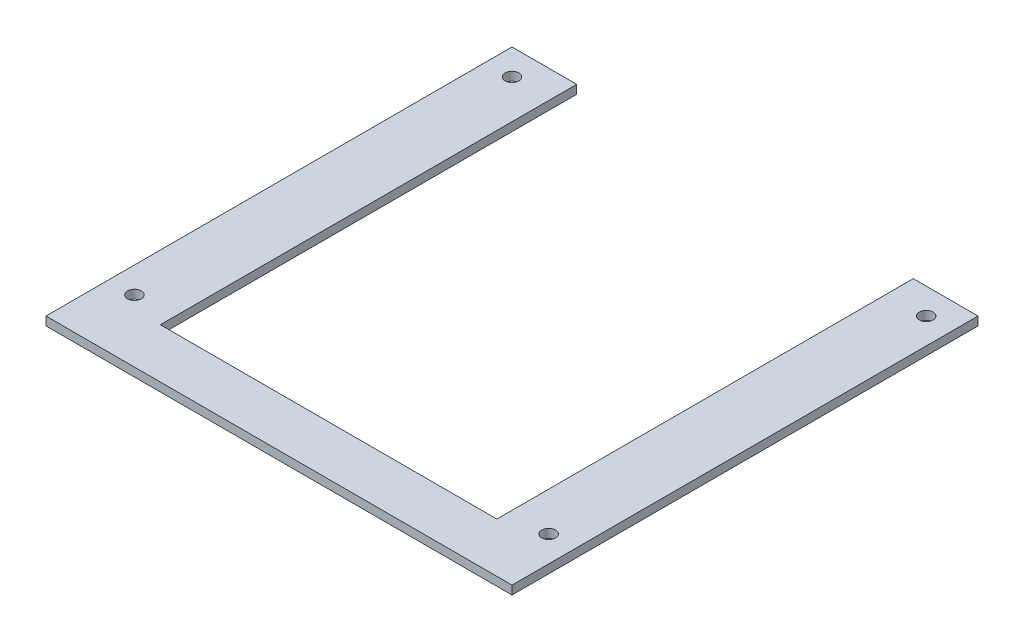
from build123d import *

# Parameters (mm, degrees)
SKETCH_1_W          = 108
SKETCH_1_H          = 108
EXTRUDE_1_DEPTH     = 2
SKETCH_2_R          = 1.6
SKETCH_2_W          = 78
SKETCH_2_H          = 96.5
CUT_EXTRUDE_1_DEPTH = 2


with BuildPart() as part:
    # 草图1 → 凸台-拉伸1 (new body)
    with BuildSketch(Plane(origin=(0, 0, 0), x_dir=(1, 0, 0), z_dir=(0, 1, 0))):
        with Locations((-3.017077799, -18.29601518)):
            Rectangle(SKETCH_1_W, SKETCH_1_H)
    extrude(amount=EXTRUDE_1_DEPTH)

    # 草图2 → 切除-拉伸1 (cut)
    with BuildSketch(Plane(origin=(0, 2, 0), x_dir=(1, 0, 0), z_dir=(0, 1, 0))):
        with Locations(Location((-51.017077799, 29.70398482, 0), (0, 0, 270))):
            Circle(SKETCH_2_R)
        with Locations(Location((44.982922201, 29.70398482, 0), (0, 0, 270))):
            Circle(SKETCH_2_R)
        with Locations(Location((-51.017077799, -57.79601518, 0), (0, 0, 270))):
            Circle(SKETCH_2_R)
        with Locations(Location((44.982922201, -57.79601518, 0), (0, 0, 270))):
            Circle(SKETCH_2_R)
        with Locations((-3.017077799, -12.54601518)):
            Rectangle(SKETCH_2_W, SKETCH_2_H)
    extrude(amount=-CUT_EXTRUDE_1_DEPTH, mode=Mode.SUBTRACT)


solid = part.part
